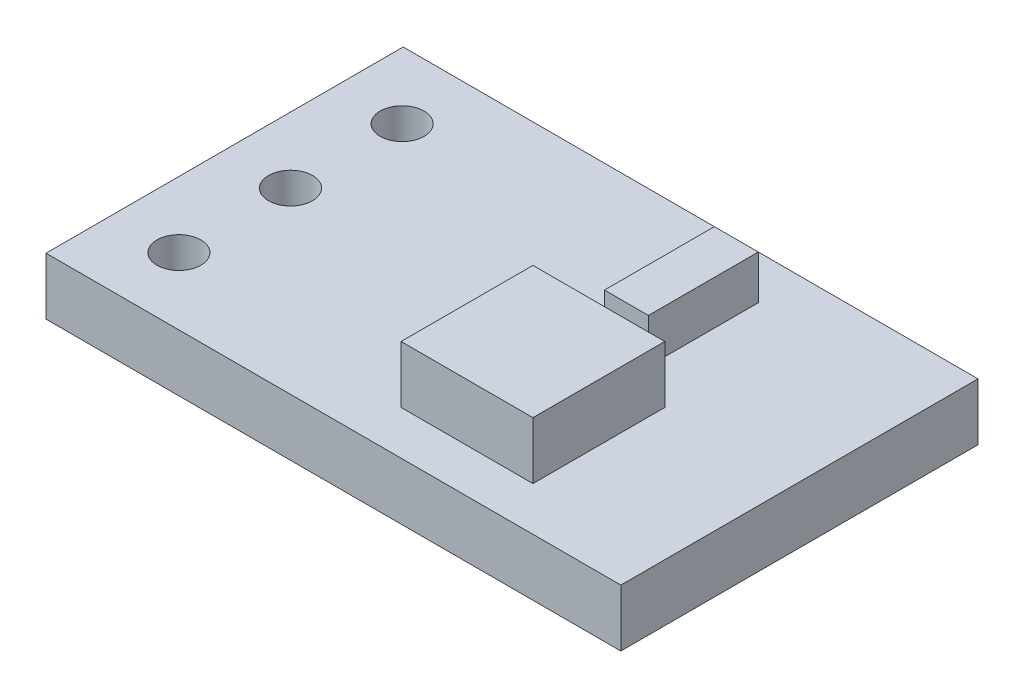
from build123d import *

# Parameters (mm, degrees)
SKETCH1_W           = 13.081
SKETCH1_H           = 8.128
SKETCH1_R           = 0.5
BOSS_EXTRUDE1_DEPTH = 1.3
SKETCH2_W           = 3
SKETCH2_H           = 3
BOSS_EXTRUDE2_DEPTH = 1.3
SKETCH3_W           = 1
SKETCH3_H           = 2.5
BOSS_EXTRUDE3_DEPTH = 1


with BuildPart() as part:
    # Sketch1 → Boss-Extrude1 (new body)
    with BuildSketch(Plane(origin=(0, 0, 0), x_dir=(1, 0, 0), z_dir=(0, 1, 0))):
        Rectangle(SKETCH1_W, SKETCH1_H)
        with Locations(Location((-5.0405, 2.54, 0), (0, 0, 270))):
            Circle(SKETCH1_R, mode=Mode.SUBTRACT)
        with Locations(Location((-5.0405, 0, 0), (0, 0, 270))):
            Circle(SKETCH1_R, mode=Mode.SUBTRACT)
        with Locations(Location((-5.0405, -2.54, 0), (0, 0, 270))):
            Circle(SKETCH1_R, mode=Mode.SUBTRACT)
    extrude(amount=BOSS_EXTRUDE1_DEPTH)

    # Sketch2 → Boss-Extrude2 (add)
    with BuildSketch(Plane(origin=(0, 1.3, 0), x_dir=(1, 0, 0), z_dir=(0, 1, 0))):
        with Locations((2.0405, -1.564)):
            Rectangle(SKETCH2_W, SKETCH2_H)
    extrude(amount=BOSS_EXTRUDE2_DEPTH)

    # Sketch3 → Boss-Extrude3 (add)
    with BuildSketch(Plane(origin=(0, 1.3, 0), x_dir=(1, 0, 0), z_dir=(0, 1, 0))):
        with Locations((2.0405, 1.814)):
            Rectangle(SKETCH3_W, SKETCH3_H)
    extrude(amount=BOSS_EXTRUDE3_DEPTH)


solid = part.part
